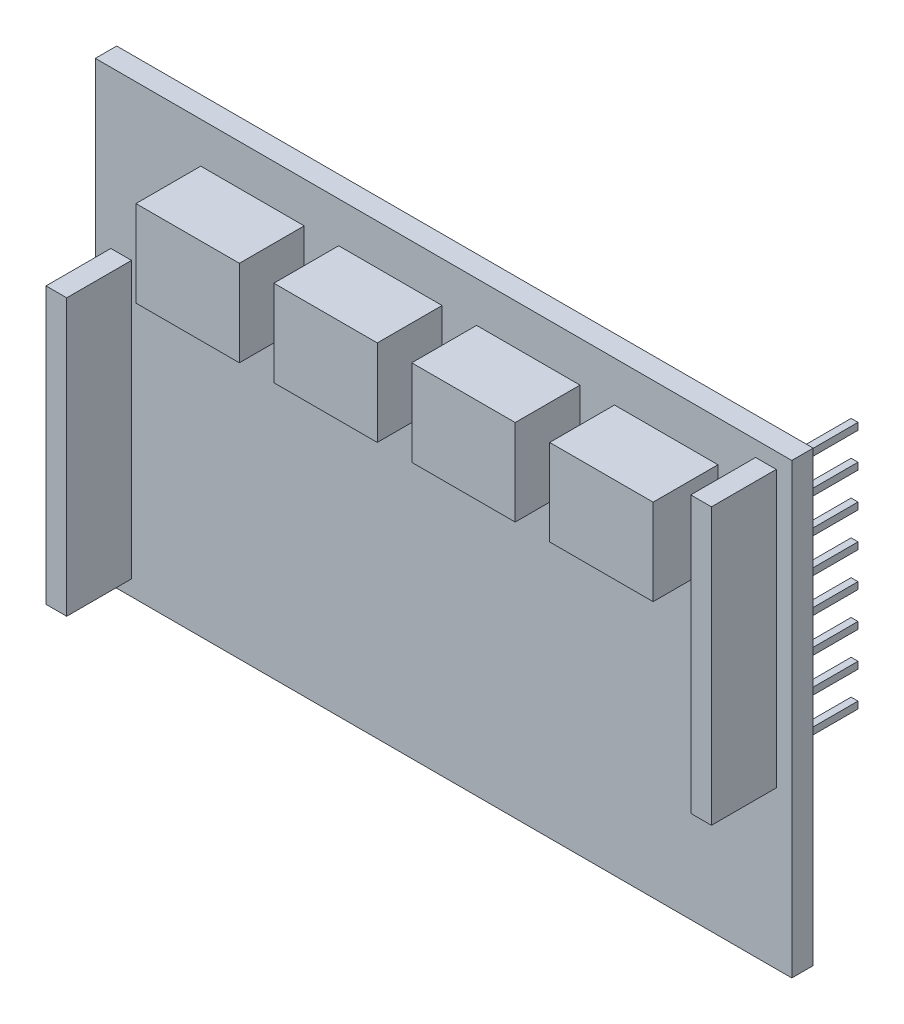
from build123d import *

# Parameters (mm, degrees)
SKETCH1_W           = 51.308
SKETCH1_H           = 33.02
BOSS_EXTRUDE1_DEPTH = 1.5748
SKETCH2_W           = 1.524
SKETCH2_H           = 20.32
BOSS_EXTRUDE2_DEPTH = 6.35
SKETCH3_W           = 7.62
SKETCH3_H           = 6.35
BOSS_EXTRUDE3_DEPTH = 6.35
LPATTERN2_COUNT     = 4
LPATTERN2_PITCH     = 10.16
SKETCH6_W           = 0.508
SKETCH6_H           = 0.508
BOSS_EXTRUDE4_DEPTH = 5.08
LPATTERN3_COUNT     = 8
LPATTERN3_PITCH     = 2.54
SKETCH7_W           = 0.508
SKETCH7_H           = 0.508
BOSS_EXTRUDE5_DEPTH = 5.08
LPATTERN4_COUNT     = 8
LPATTERN4_PITCH     = 2.54


with BuildPart() as part:
    # Sketch1 → Boss-Extrude1 (new body)
    with BuildSketch(Plane.XY):
        with Locations((25.654, 16.51)):
            Rectangle(SKETCH1_W, SKETCH1_H)
    extrude(amount=BOSS_EXTRUDE1_DEPTH)

    # Sketch2 → Boss-Extrude2 (add)
    with BuildSketch(Plane.XY):
        with Locations((49.403, 21.717)):
            Rectangle(SKETCH2_W, SKETCH2_H)
        with Locations((1.905, 11.303)):
            Rectangle(SKETCH2_W, SKETCH2_H)
    extrude(amount=BOSS_EXTRUDE2_DEPTH)

    # Sketch3 → Boss-Extrude3 (add)
    with BuildSketch(Plane.XY):
        with Locations((11.577275474, 26.851190856)):
            Rectangle(SKETCH3_W, SKETCH3_H)
    boss_extrude3 = extrude(amount=BOSS_EXTRUDE3_DEPTH)

    # LPattern2: Boss-Extrude3 ×4
    with Locations(*[(i * LPATTERN2_PITCH, 0, 0) for i in range(1, LPATTERN2_COUNT)]):
        add(boss_extrude3)

    # Sketch6 → Boss-Extrude4 (add)
    with BuildSketch(Plane(origin=(0, 0, 0), x_dir=(-1, 0, 0), z_dir=(0, 0, -1))):
        with Locations((-49.276, 30.978319105)):
            Rectangle(SKETCH6_W, SKETCH6_H)
    boss_extrude4 = extrude(amount=BOSS_EXTRUDE4_DEPTH)

    # LPattern3: Boss-Extrude4 ×8
    with Locations(*[(0, -i * LPATTERN3_PITCH, 0) for i in range(1, LPATTERN3_COUNT)]):
        add(boss_extrude4)

    # Sketch7 → Boss-Extrude5 (add)
    with BuildSketch(Plane(origin=(0, 0, 0), x_dir=(-1, 0, 0), z_dir=(0, 0, -1))):
        with Locations((-2.032, 2.032)):
            Rectangle(SKETCH7_W, SKETCH7_H)
    boss_extrude5 = extrude(amount=BOSS_EXTRUDE5_DEPTH)

    # LPattern4: Boss-Extrude5 ×8
    with Locations(*[(0, i * LPATTERN4_PITCH, 0) for i in range(1, LPATTERN4_COUNT)]):
        add(boss_extrude5)


solid = part.part
